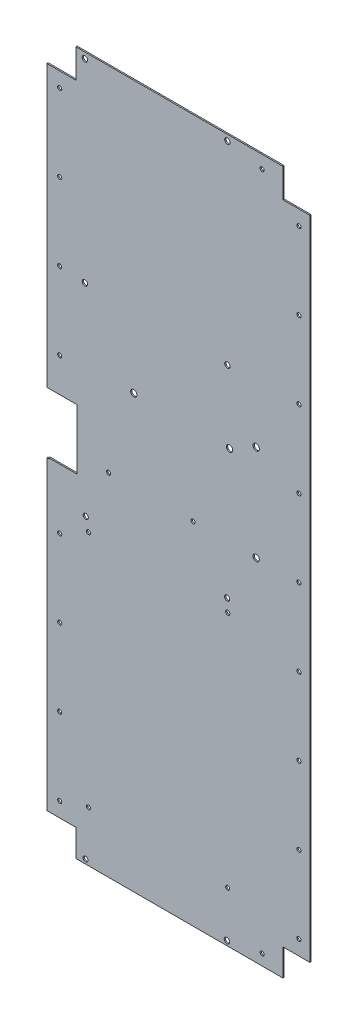
from build123d import *

# Parameters (mm, degrees)
SZKIC1_W                        = 203
SZKIC1_H                        = 545
DODANIE_WYCI_GNI_CIE1_DEPTH     = 1
WYTNIJ_WYCI_GNI_CIE1_DEPTH      = 437.073905415
WYTNIJ_WYCI_GNI_CIE1_DEPTH_BACK = 437.073905415
SZKIC2_W                        = 21
SZKIC2_H                        = 21
SZKIC3_W                        = 21
SZKIC3_H                        = 21
WYTNIJ_WYCI_GNI_CIE2_DEPTH      = 437.073905415
SZKIC4_W                        = 22
SZKIC4_H                        = 46.721864408
WYTNIJ_WYCI_GNI_CIE3_DEPTH      = 437.073905415
SZKIC5_W                        = 161
SZKIC5_H                        = 1
DODANIE_WYCI_GNI_CIE2_DEPTH     = 1.5
SZKIC6_R                        = 2.1
WYTNIJ_WYCI_GNI_CIE4_DEPTH      = 437.073905415
SZKIC7_R                        = 2.45
WYTNIJ_WYCI_GNI_CIE5_DEPTH      = 437.073905415
SZKIC8_W                        = 1
SZKIC8_H                        = 218.015474914
DODANIE_WYCI_GNI_CIE3_DEPTH     = 1.5
SZKIC9_W                        = 1
SZKIC9_H                        = 237.530488001
DODANIE_WYCI_GNI_CIE4_DEPTH     = 1.5
SZKIC10_R                       = 2
SZKIC10_R_2                     = 1.651116854
SZKIC10_R_3                     = 1.6
SZKIC10_R_4                     = 2.1
SZKIC10_R_5                     = 1.9
WYTNIJ_WYCI_GNI_CIE6_DEPTH      = 437.476994539
SZKIC11_R                       = 1.6
WYTNIJ_WYCI_GNI_CIE7_DEPTH      = 437.476994539
SZKIC12_R                       = 1.6
WYTNIJ_WYCI_GNI_CIE8_DEPTH      = 437.476994539


with BuildPart() as part:
    # Szkic1 → Dodanie-wyciągnięcie1 (new body)
    with BuildSketch(Plane.XY):
        with Locations((-14.988592715, -147.725961538)):
            Rectangle(SZKIC1_W, SZKIC1_H)
    extrude(amount=DODANIE_WYCI_GNI_CIE1_DEPTH)

    # Szkic2 → Wytnij-wyciągnięcie1 (cut, two sides: drawn at the far end of the back side and taken through both)
    with BuildSketch(Plane.XY.offset(1).offset(-WYTNIJ_WYCI_GNI_CIE1_DEPTH_BACK)):
        with Locations((-105.988592715, 114.274038462)):
            Rectangle(SZKIC2_W, SZKIC2_H)
        with Locations((76.011407285, 114.274038462)):
            Rectangle(SZKIC2_W, SZKIC2_H)
    extrude(amount=WYTNIJ_WYCI_GNI_CIE1_DEPTH + WYTNIJ_WYCI_GNI_CIE1_DEPTH_BACK, mode=Mode.SUBTRACT)

    # Szkic3 → Wytnij-wyciągnięcie2 (cut, through all)
    with BuildSketch(Plane.XY.offset(1)):
        with Locations((76.011407285, -409.725961538)):
            Rectangle(SZKIC3_W, SZKIC3_H)
        with Locations((-105.988592715, -409.725961538)):
            Rectangle(SZKIC3_W, SZKIC3_H)
    extrude(amount=-WYTNIJ_WYCI_GNI_CIE2_DEPTH, mode=Mode.SUBTRACT)

    # Szkic4 → Wytnij-wyciągnięcie3 (cut, through all)
    with BuildSketch(Plane.XY.offset(1)):
        with Locations((-105.488592715, -137.602368656)):
            Rectangle(SZKIC4_W, SZKIC4_H)
    extrude(amount=-WYTNIJ_WYCI_GNI_CIE3_DEPTH, mode=Mode.SUBTRACT)

    # Szkic5 → Dodanie-wyciągnięcie2 (add)
    with BuildSketch(Plane(origin=(0, 124.774038462, 0), x_dir=(1, 0, 0), z_dir=(0, 1, 0))):
        with Locations((-14.988592715, -0.5)):
            Rectangle(SZKIC5_W, SZKIC5_H)
    extrude(amount=DODANIE_WYCI_GNI_CIE2_DEPTH)

    # Szkic6 → Wytnij-wyciągnięcie4 (cut, through all)
    with BuildSketch(Plane.XY.offset(1)):
        with Locations((22.411407285, -29.125961538)):
            Circle(SZKIC6_R)
        with Locations((22.411407285, 121.674038462)):
            Circle(SZKIC6_R)
        with Locations((-88.388592715, 121.674038462)):
            Circle(SZKIC6_R)
        with Locations((-88.388592715, -29.125961538)):
            Circle(SZKIC6_R)
    extrude(amount=-WYTNIJ_WYCI_GNI_CIE4_DEPTH, mode=Mode.SUBTRACT)

    # Szkic7 → Wytnij-wyciągnięcie5 (cut, through all)
    with BuildSketch(Plane.XY.offset(1)):
        with Locations((-50.438592715, -84.464522811)):
            Circle(SZKIC7_R)
        with Locations((24.061407285, -84.464522811)):
            Circle(SZKIC7_R)
        with Locations((44.772846012, -73.225961538)):
            Circle(SZKIC7_R)
        with Locations((44.772846012, -147.725961538)):
            Circle(SZKIC7_R)
    extrude(amount=-WYTNIJ_WYCI_GNI_CIE5_DEPTH, mode=Mode.SUBTRACT)

    # Szkic8 → Dodanie-wyciągnięcie3 (add)
    with BuildSketch(Plane.ZY.offset(116.488592715)):
        with Locations((0.5, -5.233698995)):
            Rectangle(SZKIC8_W, SZKIC8_H)
    extrude(amount=DODANIE_WYCI_GNI_CIE3_DEPTH)

    # Szkic9 → Dodanie-wyciągnięcie4 (add)
    with BuildSketch(Plane.ZY.offset(116.488592715)):
        with Locations((0.5, -280.460717538)):
            Rectangle(SZKIC9_W, SZKIC9_H)
    extrude(amount=DODANIE_WYCI_GNI_CIE4_DEPTH)

    # Szkic10 → Wytnij-wyciągnięcie6 (cut, through all)
    with BuildSketch(Plane.XY.offset(1)):
        with Locations((22.211407285, -186.041328015)):
            Circle(SZKIC10_R)
        with Locations((22.662524139, -195.692444868)):
            Circle(SZKIC10_R_2)
        with Locations((-87.738592715, -186.041328015)):
            Circle(SZKIC10_R)
        with Locations((-85.588592715, -195.641328015)):
            Circle(SZKIC10_R_3)
        with Locations((-85.588592715, -380.941328015)):
            Circle(SZKIC10_R_3)
        with Locations((22.611407285, -380.941328015)):
            Circle(SZKIC10_R_3)
        with Locations((22.011407285, -416.791328015)):
            Circle(SZKIC10_R_4)
        with Locations((-87.888592715, -416.791328015)):
            Circle(SZKIC10_R_5)
    extrude(amount=-WYTNIJ_WYCI_GNI_CIE6_DEPTH, mode=Mode.SUBTRACT)

    # Szkic11 → Wytnij-wyciągnięcie7 (cut, through all)
    with BuildSketch(Plane(origin=(0, 0, 0), x_dir=(-1, 0, 0), z_dir=(0, 0, -1))):
        with Locations((4.325302662, -147.725961538)):
            Circle(SZKIC11_R)
        with Locations((69.987506483, -147.725961538)):
            Circle(SZKIC11_R)
        with Locations((-78.011407285, -147.725961538)):
            Circle(SZKIC11_R)
    extrude(amount=-WYTNIJ_WYCI_GNI_CIE7_DEPTH, mode=Mode.SUBTRACT)

    # Szkic12 → Wytnij-wyciągnięcie8 (cut, through all)
    with BuildSketch(Plane.XY.offset(1)):
        with Locations((-107.988592715, -87.725961538)):
            Circle(SZKIC12_R)
        with Locations((-107.988592715, -27.725961538)):
            Circle(SZKIC12_R)
        with Locations((-107.988592715, 32.274038462)):
            Circle(SZKIC12_R)
        with Locations((-107.988592715, 92.274038462)):
            Circle(SZKIC12_R)
        with Locations((-107.988592715, -207.725961538)):
            Circle(SZKIC12_R)
        with Locations((-107.988592715, -267.725961538)):
            Circle(SZKIC12_R)
        with Locations((-107.988592715, -327.725961538)):
            Circle(SZKIC12_R)
        with Locations((-107.988592715, -387.725961538)):
            Circle(SZKIC12_R)
        with Locations((78.011407285, 92.274038462)):
            Circle(SZKIC12_R)
        with Locations((78.011407285, 32.274038462)):
            Circle(SZKIC12_R)
        with Locations((78.011407285, -27.725961538)):
            Circle(SZKIC12_R)
        with Locations((78.011407285, -87.725961538)):
            Circle(SZKIC12_R)
        with Locations((78.011407285, -207.725961538)):
            Circle(SZKIC12_R)
        with Locations((78.011407285, -267.725961538)):
            Circle(SZKIC12_R)
        with Locations((78.011407285, -327.725961538)):
            Circle(SZKIC12_R)
        with Locations((78.011407285, -387.725961538)):
            Circle(SZKIC12_R)
        with Locations((49.40530762, 116.274038462)):
            Circle(SZKIC12_R)
        with Locations((49.40530762, -411.725961538)):
            Circle(SZKIC12_R)
    extrude(amount=-WYTNIJ_WYCI_GNI_CIE8_DEPTH, mode=Mode.SUBTRACT)


solid = part.part
